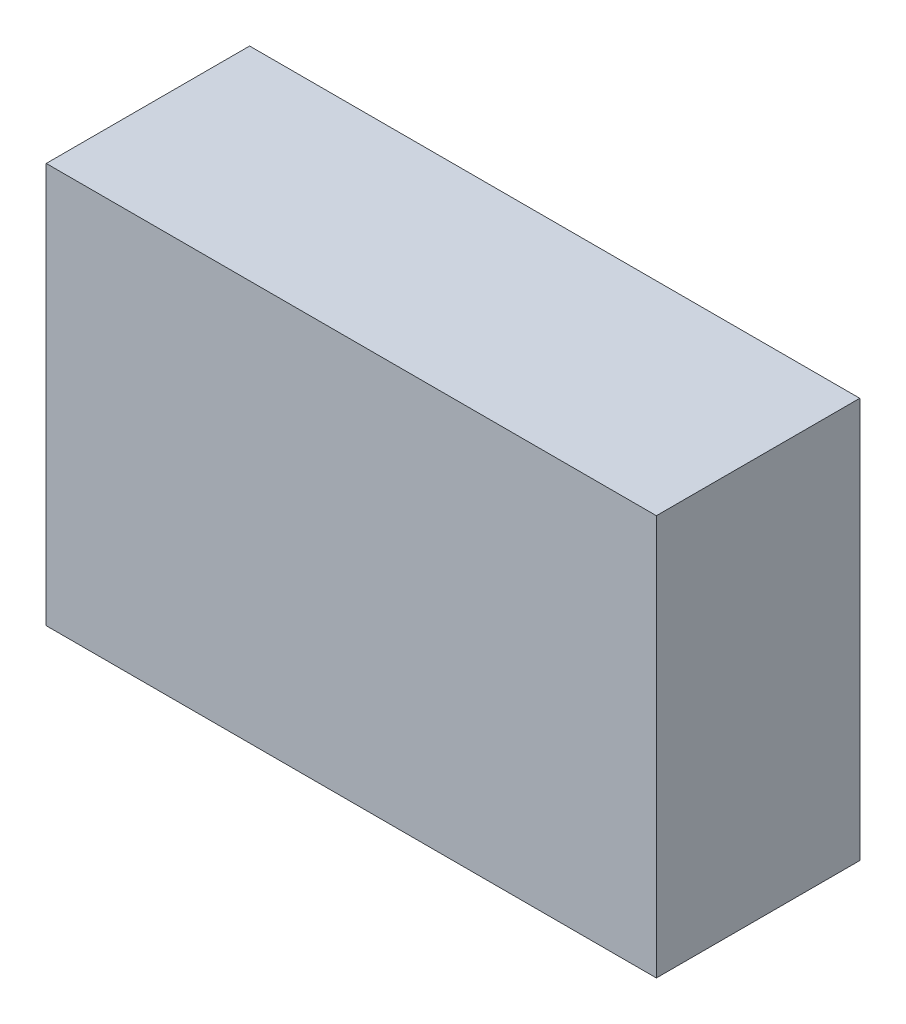
from build123d import *

# Parameters (mm, degrees)
SKETCH1_W           = 7.62
SKETCH1_H           = 2.54
BOSS_EXTRUDE1_DEPTH = 5


with BuildPart() as part:
    # Sketch1 → Boss-Extrude1 (new body)
    with BuildSketch(Plane(origin=(0, 0, 0), x_dir=(1, 0, 0), z_dir=(0, 1, 0))):
        Rectangle(SKETCH1_W, SKETCH1_H)
    extrude(amount=BOSS_EXTRUDE1_DEPTH)


solid = part.part
